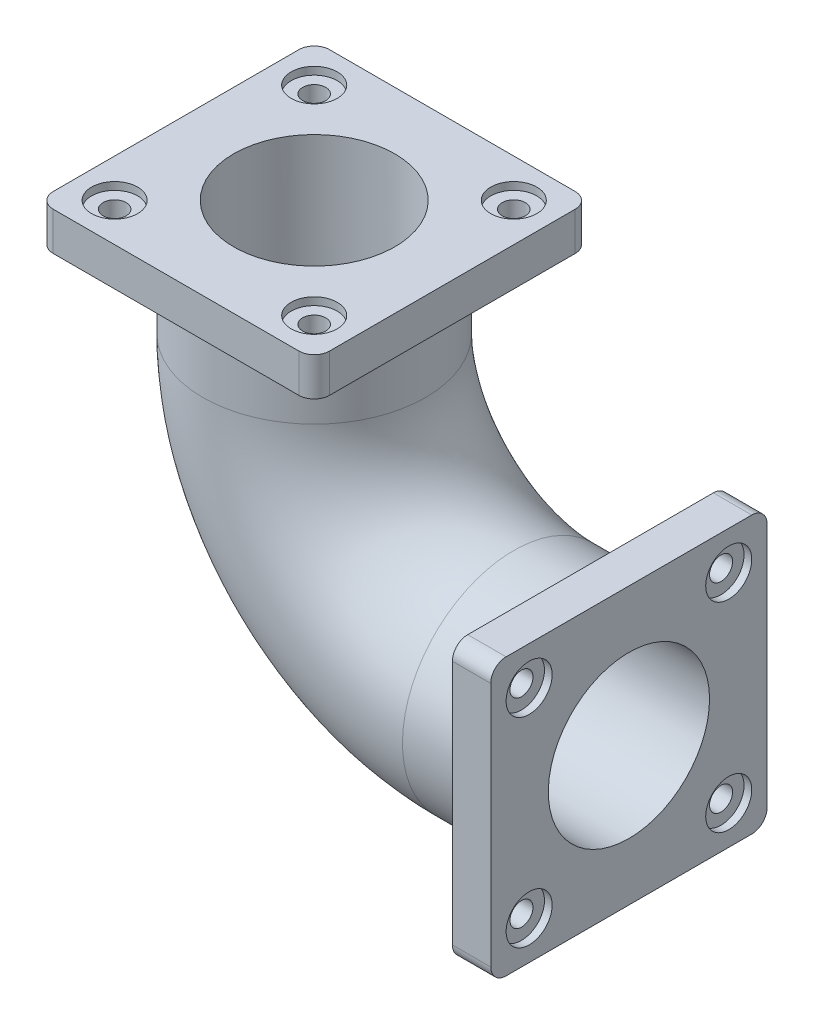
from build123d import *

# Parameters (mm, degrees)
SKETCH2_R           = 145
SKETCH2_R_2         = 105
BOSS_EXTRUDE1_START = -50
SKETCH3_W           = 360
SKETCH3_H           = 360
SKETCH3_R           = 145
SKETCH3_R_2         = 105
BOSS_EXTRUDE1_DEPTH = 50
FILLET1_R           = 20
SKETCH6_R           = 145
SKETCH6_R_2         = 105
BOSS_EXTRUDE2_DEPTH = 50
SKETCH7_R           = 30
CUT_EXTRUDE1_DEPTH  = 10
CUT_EXTRUDE2_REACH  = 734.735
SKETCH8_R           = 15
CIRPATTERN1_COUNT   = 4
SKETCH9_R           = 30
CUT_EXTRUDE3_DEPTH  = 10
CUT_EXTRUDE4_REACH  = 848.699
SKETCH10_R          = 15
CIRPATTERN2_COUNT   = 4


with BuildPart() as part:
    # Sweep-Thin1: sweep along a path in Sketch1
    with BuildLine(Plane.XY) as sweep_thin1_path:
        Line((0, 0), (-150, 0))
        ThreePointArc((-150, 0), (-333.847763109, 76.152236891), (-410, 260))
        Line((-410, 260), (-410, 410))
    # Sketch2 → Sweep-Thin1 (sweep)
    with BuildSketch(Plane(origin=(0, 0, 0), x_dir=(0, 0, -1), z_dir=(1, 0, 0))):
        Circle(SKETCH2_R)
        Circle(SKETCH2_R_2, mode=Mode.SUBTRACT)
    sweep(path=sweep_thin1_path.line)

    # Sketch3 → Boss-Extrude1 (add)
    # profile 1 of 2: a face of its own
    with BuildSketch(Plane(origin=(0, 0, 0), x_dir=(0, 0, -1), z_dir=(1, 0, 0)).offset(BOSS_EXTRUDE1_START)):
        Rectangle(SKETCH3_W, SKETCH3_H)
        with Locations(Location((0, 0, 0), (0, 0, 270))):
            Circle(SKETCH3_R, mode=Mode.SUBTRACT)
    # profile 2 of 2: a face of its own
    with BuildSketch(Plane(origin=(0, 0, 0), x_dir=(0, 0, -1), z_dir=(1, 0, 0)).offset(BOSS_EXTRUDE1_START)):
        with Locations(Location((0, 0, 0), (0, 0, 270))):
            Circle(SKETCH3_R)
        with Locations(Location((0, 0, 0), (0, 0, 270))):
            Circle(SKETCH3_R_2, mode=Mode.SUBTRACT)
    extrude(amount=BOSS_EXTRUDE1_DEPTH)

    # Fillet1
    fillet1_edges = [part.edges().sort_by_distance(p)[0] for p in [
        (-25, 180, -180),
        (-25, -180, -180),
        (-25, -180, 180),
        (-25, 180, 180),
    ]]
    fillet(fillet1_edges, radius=FILLET1_R)

    # Sketch6 → Boss-Extrude2 (add)
    # profile 1 of 2: a face of its own
    with BuildSketch(Plane(origin=(0, 410, 0), x_dir=(1, 0, 0), z_dir=(0, 1, 0))):
        with BuildLine():
            Line((-570, -180), (-250, -180))
            ThreePointArc((-250, -180), (-235.857864376, -174.142135624), (-230, -160))
            Line((-230, -160), (-230, 160))
            ThreePointArc((-230, 160), (-235.857864376, 174.142135624), (-250, 180))
            Line((-250, 180), (-570, 180))
            ThreePointArc((-570, 180), (-584.142135624, 174.142135624), (-590, 160))
            Line((-590, 160), (-590, -160))
            ThreePointArc((-590, -160), (-584.142135624, -174.142135624), (-570, -180))
        make_face()
        with Locations(Location((-410, 0, 0), (0, 0, 270))):
            Circle(SKETCH6_R, mode=Mode.SUBTRACT)
    # profile 2 of 2: a face of its own
    with BuildSketch(Plane(origin=(0, 410, 0), x_dir=(1, 0, 0), z_dir=(0, 1, 0))):
        with Locations(Location((-410, 0, 0), (0, 0, 270))):
            Circle(SKETCH6_R)
        with Locations(Location((-410, 0, 0), (0, 0, 180))):
            Circle(SKETCH6_R_2, mode=Mode.SUBTRACT)
    extrude(amount=-BOSS_EXTRUDE2_DEPTH)

    # Sketch7 → Cut-Extrude1 (cut)
    with BuildSketch(Plane(origin=(0, 0, 0), x_dir=(0, 0, -1), z_dir=(1, 0, 0))):
        with Locations((-130, 130)):
            Circle(SKETCH7_R)
    cut_extrude1 = extrude(amount=-CUT_EXTRUDE1_DEPTH, mode=Mode.SUBTRACT)

    # Sketch8 → Cut-Extrude2 (cut, up to next)
    with BuildSketch(Plane(origin=(-10, 0, 0), x_dir=(0, 0, -1), z_dir=(1, 0, 0)), mode=Mode.PRIVATE) as cut_extrude2_sk1:
        with Locations((-130, 130)):
            Circle(SKETCH8_R)
    cut_extrude2_tool1 = extrude(cut_extrude2_sk1.sketch, amount=-CUT_EXTRUDE2_REACH, mode=Mode.PRIVATE) & part.part
    cut_extrude2 = cut_extrude2_tool1.solids().sort_by_distance((-10, 130, 130))[0]
    add(cut_extrude2, mode=Mode.SUBTRACT)

    # CirPattern1: Cut-Extrude1, Cut-Extrude2 ×4 about axis
    cirpattern1_axis = Axis((0, 0, 0), (1, 0, 0))
    add([cut_extrude1.rotate(cirpattern1_axis, i * 360 / CIRPATTERN1_COUNT) for i in range(1, CIRPATTERN1_COUNT)], mode=Mode.SUBTRACT)
    add([cut_extrude2.rotate(cirpattern1_axis, i * 360 / CIRPATTERN1_COUNT) for i in range(1, CIRPATTERN1_COUNT)], mode=Mode.SUBTRACT)

    # Sketch9 → Cut-Extrude3 (cut)
    with BuildSketch(Plane(origin=(0, 410, 0), x_dir=(1, 0, 0), z_dir=(0, 1, 0))):
        with Locations(Location((-540, 130, 0), (0, 0, 270))):
            Circle(SKETCH9_R)
    cut_extrude3 = extrude(amount=-CUT_EXTRUDE3_DEPTH, mode=Mode.SUBTRACT)

    # Sketch10 → Cut-Extrude4 (cut, up to next)
    with BuildSketch(Plane(origin=(0, 400, 0), x_dir=(1, 0, 0), z_dir=(0, 1, 0)), mode=Mode.PRIVATE) as cut_extrude4_sk1:
        with Locations(Location((-540, 130, 0), (0, 0, 270))):
            Circle(SKETCH10_R)
    cut_extrude4_tool1 = extrude(cut_extrude4_sk1.sketch, amount=-CUT_EXTRUDE4_REACH, mode=Mode.PRIVATE) & part.part
    cut_extrude4 = cut_extrude4_tool1.solids().sort_by_distance((-540, 400, -130))[0]
    add(cut_extrude4, mode=Mode.SUBTRACT)

    # CirPattern2: Cut-Extrude3, Cut-Extrude4 ×4 about axis
    cirpattern2_axis = Axis((-410, 0, 0), (0, 1, 0))
    add([cut_extrude3.rotate(cirpattern2_axis, i * 360 / CIRPATTERN2_COUNT) for i in range(1, CIRPATTERN2_COUNT)], mode=Mode.SUBTRACT)
    add([cut_extrude4.rotate(cirpattern2_axis, i * 360 / CIRPATTERN2_COUNT) for i in range(1, CIRPATTERN2_COUNT)], mode=Mode.SUBTRACT)


solid = part.part
